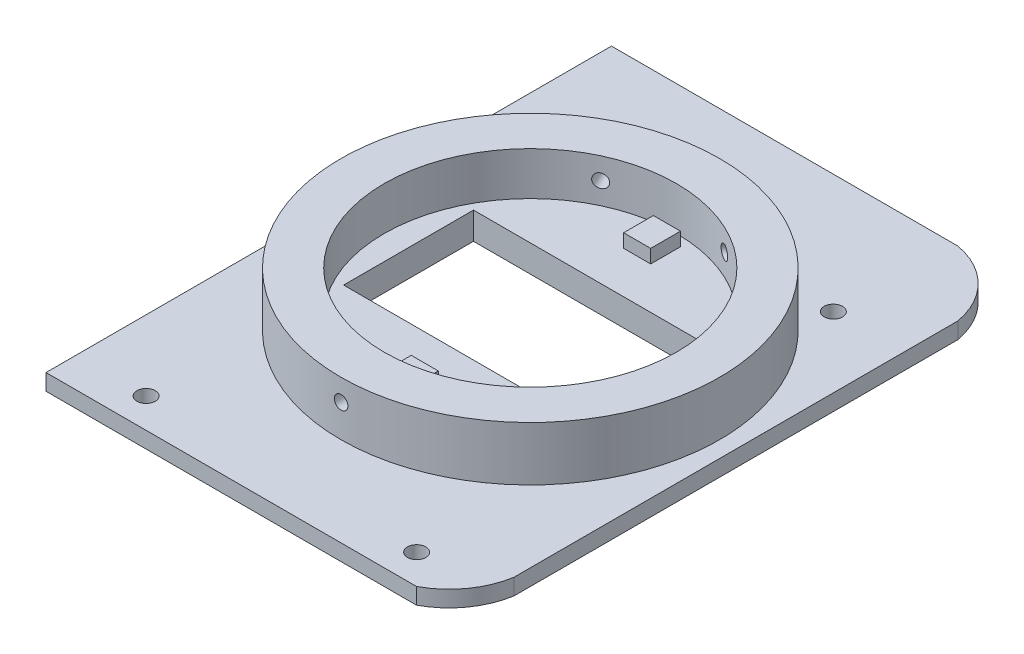
from build123d import *

# Parameters (mm, degrees)
SKETCH1_W                  = 60
SKETCH1_H                  = 102
BOSS_EXTRUDE1_DEPTH        = 3
M3_CLEARANCE_HOLE1_D       = 3.4
SKETCH5_R                  = 35
BOSS_EXTRUDE2_DEPTH        = 10
SKETCH6_R                  = 27
CUT_EXTRUDE1_DEPTH         = 8
SKETCH8_W                  = 5
SKETCH8_H                  = 5.5
BOSS_EXTRUDE3_DEPTH        = 2.5
SKETCH9_W                  = 5
SKETCH9_H                  = 5
BOSS_EXTRUDE4_DEPTH        = 2.5
SKETCH10_W                 = 45
SKETCH10_H                 = 24
CUT_EXTRUDE2_DEPTH         = 63.369864518
SKETCH12_W                 = 60
SKETCH12_H                 = 2
CUT_EXTRUDE3_DEPTH         = 63.657800791
SKETCH13_W                 = 60
SKETCH13_H                 = 3
CUT_EXTRUDE4_DEPTH         = 63.657800791
SKETCH14_W                 = 60
SKETCH14_H                 = 3
BOSS_EXTRUDE5_DEPTH        = 9
SKETCH16_W                 = 106
SKETCH16_H                 = 3
BOSS_EXTRUDE6_DEPTH        = 8
SKETCH17_W                 = 106
SKETCH17_H                 = 3
BOSS_EXTRUDE7_DEPTH        = 8
CUT_EXTRUDE5_DEPTH         = 15
CUT_EXTRUDE6_DEPTH         = 71.057119553
M3X0_5_TAPPED_HOLE1_REACH  = 102.233
M3X0_5_TAPPED_HOLE1_BORE_R = 1.25
M3X0_5_TAPPED_HOLE2_REACH  = 102.233
M3X0_5_TAPPED_HOLE2_BORE_R = 1.25
M3X0_5_TAPPED_HOLE3_REACH  = 98.284
M3X0_5_TAPPED_HOLE3_BORE_R = 1.25
SKETCH28_W                 = 76
SKETCH28_H                 = 1.5
CUT_EXTRUDE7_DEPTH         = 71.057119567


with BuildPart() as part:
    # Sketch1 → Boss-Extrude1 (new body)
    with BuildSketch(Plane(origin=(0, 0, 0), x_dir=(1, 0, 0), z_dir=(0, 1, 0))):
        Rectangle(SKETCH1_W, SKETCH1_H)
    extrude(amount=BOSS_EXTRUDE1_DEPTH)

    # M3 Clearance Hole1 (through all)
    with Locations(Plane(origin=(-25, 3, -36), x_dir=(0, 0, 1), z_dir=(0, 1, 0))):
        with Locations((0, 0), (0, 50), (77, 0), (77, 50)):
            Hole(M3_CLEARANCE_HOLE1_D / 2)

    # Sketch5 → Boss-Extrude2 (add)
    with BuildSketch(Plane(origin=(0, 3, 0), x_dir=(1, 0, 0), z_dir=(0, 1, 0))):
        with Locations(Location((0, 5, 0), (0, 0, 148.997280866))):
            Circle(SKETCH5_R)
    extrude(amount=BOSS_EXTRUDE2_DEPTH)

    # Sketch6 → Cut-Extrude1 (cut)
    with BuildSketch(Plane(origin=(0, 13, 0), x_dir=(1, 0, 0), z_dir=(0, 1, 0))):
        with Locations(Location((0, 5, 0), (0, 0, 270))):
            Circle(SKETCH6_R)
    extrude(amount=-CUT_EXTRUDE1_DEPTH, mode=Mode.SUBTRACT)

    # Sketch8 → Boss-Extrude3 (add)
    with BuildSketch(Plane(origin=(0, 5, 0), x_dir=(1, 0, 0), z_dir=(0, 1, 0))):
        with Locations((0, 27.5)):
            Rectangle(SKETCH8_W, SKETCH8_H)
    extrude(amount=BOSS_EXTRUDE3_DEPTH)

    # Sketch9 → Boss-Extrude4 (add)
    with BuildSketch(Plane(origin=(0, 5, 0), x_dir=(1, 0, 0), z_dir=(0, 1, 0))):
        with Locations((0, -17)):
            Rectangle(SKETCH9_W, SKETCH9_H)
    extrude(amount=BOSS_EXTRUDE4_DEPTH)

    # Sketch10 → Cut-Extrude2 (cut, through all)
    with BuildSketch(Plane(origin=(0, 5, 0), x_dir=(1, 0, 0), z_dir=(0, 1, 0))):
        with Locations((0, 5)):
            Rectangle(SKETCH10_W, SKETCH10_H)
    extrude(amount=-CUT_EXTRUDE2_DEPTH, mode=Mode.SUBTRACT)

    # Sketch12 → Cut-Extrude3 (cut, through all)
    with BuildSketch(Plane(origin=(0, 3, 0), x_dir=(1, 0, 0), z_dir=(0, 1, 0))):
        with Locations((0, 50)):
            Rectangle(SKETCH12_W, SKETCH12_H)
    extrude(amount=-CUT_EXTRUDE3_DEPTH, mode=Mode.SUBTRACT)

    # Sketch13 → Cut-Extrude4 (cut, through all)
    with BuildSketch(Plane(origin=(0, 3, 0), x_dir=(1, 0, 0), z_dir=(0, 1, 0))):
        with Locations((0, -49.5)):
            Rectangle(SKETCH13_W, SKETCH13_H)
    extrude(amount=-CUT_EXTRUDE4_DEPTH, mode=Mode.SUBTRACT)

    # Sketch14 → Boss-Extrude5 (add)
    with BuildSketch(Plane(origin=(0, 0, -49), x_dir=(-1, 0, 0), z_dir=(0, 0, -1))):
        with Locations((0, 1.5)):
            Rectangle(SKETCH14_W, SKETCH14_H)
    extrude(amount=BOSS_EXTRUDE5_DEPTH)

    # Sketch16 → Boss-Extrude6 (add)
    with BuildSketch(Plane.ZY.offset(30)):
        with Locations((-5, 1.5)):
            Rectangle(SKETCH16_W, SKETCH16_H)
    extrude(amount=BOSS_EXTRUDE6_DEPTH)

    # Sketch17 → Boss-Extrude7 (add)
    with BuildSketch(Plane(origin=(30, 0, 0), x_dir=(0, 0, -1), z_dir=(1, 0, 0))):
        with Locations((5, 1.5)):
            Rectangle(SKETCH17_W, SKETCH17_H)
    extrude(amount=BOSS_EXTRUDE7_DEPTH)

    # Sketch18 → Cut-Extrude5 (cut)
    with BuildSketch(Plane(origin=(0, 3, 0), x_dir=(1, 0, 0), z_dir=(0, 1, 0))):
        with BuildLine():
            Line((38, 46), (38, 58))
            Line((38, 58), (26, 58))
            ThreePointArc((26, 58), (33.884200012, 53.884200012), (38, 46))
        make_face()
    extrude(amount=-CUT_EXTRUDE5_DEPTH, mode=Mode.SUBTRACT)

    # Sketch19 → Cut-Extrude6 (cut, through all)
    with BuildSketch(Plane(origin=(0, 3, 0), x_dir=(1, 0, 0), z_dir=(0, 1, 0))):
        with BuildLine():
            Line((38, -36), (38, -48))
            Line((38, -48), (26, -48))
            ThreePointArc((26, -48), (33.934883201, -43.934883201), (38, -36))
        make_face()
    extrude(amount=-CUT_EXTRUDE6_DEPTH, mode=Mode.SUBTRACT)

    # M3x0.5 Tapped Hole1 bore (on position points) → M3x0.5 Tapped Hole1 (cut, up to next)
    with BuildSketch(Plane(origin=(-14.832396974, 9, -36.701734968), x_dir=(-0.905763856237, 0, 0.423782770691), z_dir=(-0.423782770691, 0, -0.905763856237)), mode=Mode.PRIVATE) as m3x0_5_tapped_hole1_sk1:
        Circle(M3X0_5_TAPPED_HOLE1_BORE_R)
    m3x0_5_tapped_hole1_tool1 = extrude(m3x0_5_tapped_hole1_sk1.sketch, amount=-M3X0_5_TAPPED_HOLE1_REACH, mode=Mode.PRIVATE) & part.part
    add(m3x0_5_tapped_hole1_tool1.solids().sort_by_distance((-14.832397, 9, -36.701735))[0], mode=Mode.SUBTRACT)

    # M3x0.5 Tapped Hole2 bore (on position points) → M3x0.5 Tapped Hole2 (cut, up to next)
    with BuildSketch(Plane(origin=(14.832396974, 9, -36.701734968), x_dir=(-0.905763856237, 0, -0.423782770691), z_dir=(0.423782770691, 0, -0.905763856237)), mode=Mode.PRIVATE) as m3x0_5_tapped_hole2_sk1:
        Circle(M3X0_5_TAPPED_HOLE2_BORE_R)
    m3x0_5_tapped_hole2_tool1 = extrude(m3x0_5_tapped_hole2_sk1.sketch, amount=-M3X0_5_TAPPED_HOLE2_REACH, mode=Mode.PRIVATE) & part.part
    add(m3x0_5_tapped_hole2_tool1.solids().sort_by_distance((14.832397, 9, -36.701735))[0], mode=Mode.SUBTRACT)

    # M3x0.5 Tapped Hole3 bore (on position points) → M3x0.5 Tapped Hole3 (cut, up to next)
    with BuildSketch(Plane(origin=(0.02, 9, 29.999994286), x_dir=(0.999999836735, 0, -0.000571428571), z_dir=(0.000571428571, 0, 0.999999836735)), mode=Mode.PRIVATE) as m3x0_5_tapped_hole3_sk1:
        Circle(M3X0_5_TAPPED_HOLE3_BORE_R)
    m3x0_5_tapped_hole3_tool1 = extrude(m3x0_5_tapped_hole3_sk1.sketch, amount=-M3X0_5_TAPPED_HOLE3_REACH, mode=Mode.PRIVATE) & part.part
    add(m3x0_5_tapped_hole3_tool1.solids().sort_by_distance((0.02, 9, 29.999994))[0], mode=Mode.SUBTRACT)

    # Sketch28 → Cut-Extrude7 (cut, through all)
    with BuildSketch(Plane(origin=(0, 3, 0), x_dir=(1, 0, 0), z_dir=(0, 1, 0))):
        with Locations((0, -47.25)):
            Rectangle(SKETCH28_W, SKETCH28_H)
    extrude(amount=-CUT_EXTRUDE7_DEPTH, mode=Mode.SUBTRACT)


solid = part.part
